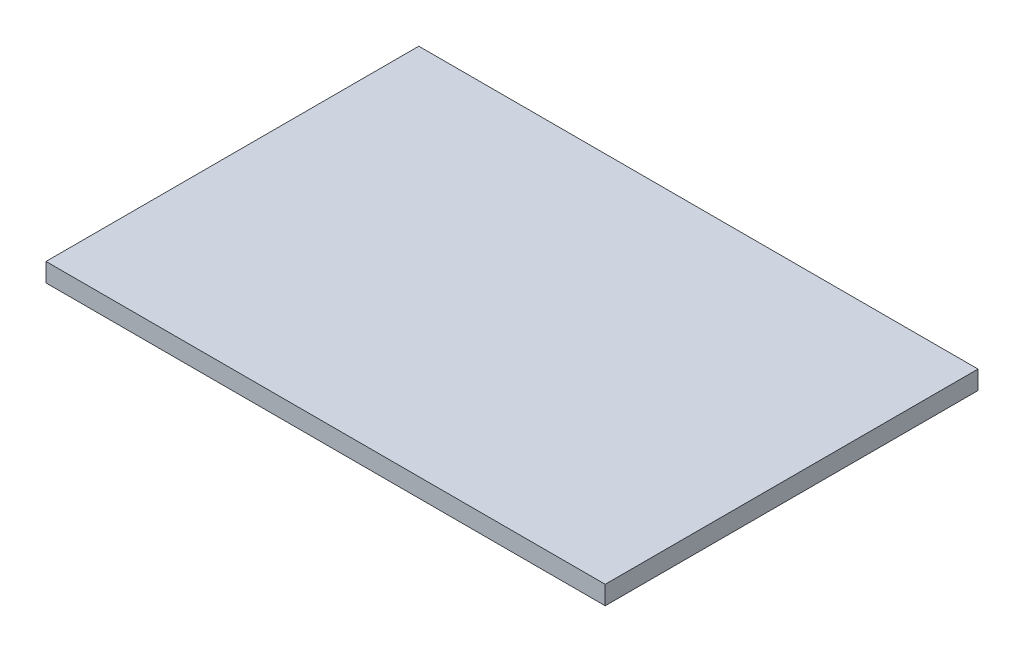
from build123d import *

# Parameters (mm, degrees)
SKETCH1_W      = 76.2
SKETCH1_H      = 50.8
EXTRUDE1_DEPTH = 2.54


with BuildPart() as part:
    # Sketch1 → Extrude1 (new body)
    with BuildSketch(Plane(origin=(0, 0, 0), x_dir=(1, 0, 0), z_dir=(0, 1, 0))):
        with Locations((8.781657892, 20.642185141)):
            Rectangle(SKETCH1_W, SKETCH1_H)
    extrude(amount=EXTRUDE1_DEPTH)


solid = part.part
